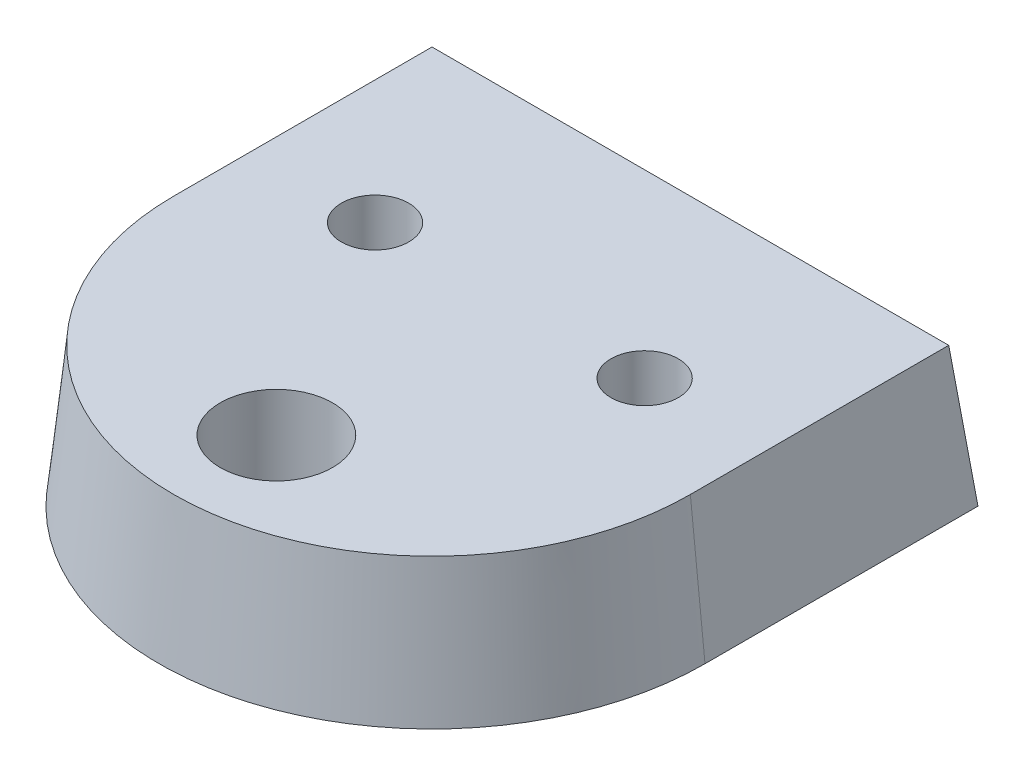
from build123d import *

# Parameters (mm, degrees)
BOSS_EXTRUDE1_DEPTH = 6.2
BOSS_EXTRUDE1_DRAFT = 6
SKETCH2_R           = 1.5
SKETCH2_R_2         = 2.5
CUT_EXTRUDE1_DEPTH  = 19.269236809
SHELL1_T            = -1.2


with BuildPart() as part:
    # Sketch1 → Boss-Extrude1 (with draft: the straight prism first)
    with BuildSketch(Plane(origin=(0, 0, 0), x_dir=(1, 0, 0), z_dir=(0, 1, 0))):
        with BuildLine():
            Line((-11.5, 11.5), (-11.5, 0))
            ThreePointArc((-11.5, 0), (0, -11.5), (11.5, 0))
            Line((11.5, 0), (11.5, 11.5))
            Line((11.5, 11.5), (-11.5, 11.5))
        make_face()
    extrude(amount=-BOSS_EXTRUDE1_DEPTH)
    # Boss-Extrude1: the draft: its side faces are tilted about the plane it starts from
    boss_extrude1_sides = [part.faces().sort_by_distance(p)[0] for p in [
        (11.5, -3.1, -5.75),
        (0, -3.1, -11.5),
        (-11.5, -3.1, -5.75),
        (0, -3.1, 11.5),
    ]]
    draft(boss_extrude1_sides, Plane(origin=(0, 0, 0), x_dir=(1, 0, 0), z_dir=(0, 1, 0)), BOSS_EXTRUDE1_DRAFT)

    # Sketch2 → Cut-Extrude1 (cut, through all)
    with BuildSketch(Plane(origin=(0, 0, 0), x_dir=(1, 0, 0), z_dir=(0, 1, 0))):
        with Locations(Location((-6, 3.464101615, 0), (0, 0, 270))):
            Circle(SKETCH2_R)
        with Locations(Location((6, 3.464101615, 0), (0, 0, 270))):
            Circle(SKETCH2_R)
        with Locations(Location((0, -6.92820323, 0), (0, 0, 270))):
            Circle(SKETCH2_R_2)
    extrude(amount=-CUT_EXTRUDE1_DEPTH, mode=Mode.SUBTRACT)

    # Shell1
    shell1_openings = [part.faces().sort_by_distance(p)[0] for p in [
        (0, -6.2, -1.388400602),
    ]]
    offset(amount=SHELL1_T, openings=shell1_openings)


solid = part.part
